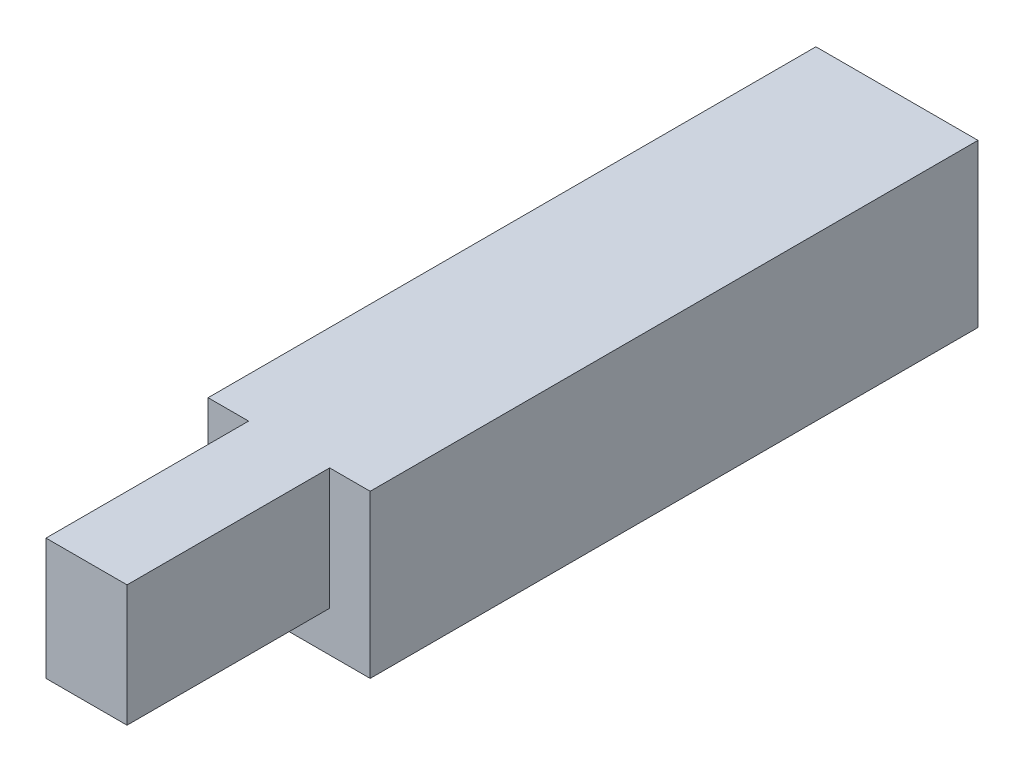
from build123d import *

# Parameters (mm, degrees)
SKETCH1_W           = 10
SKETCH1_H           = 10
BOSS_EXTRUDE1_DEPTH = 37.5
SKETCH2_W           = 5
SKETCH2_H           = 7.5
BOSS_EXTRUDE2_DEPTH = 12.5


with BuildPart() as part:
    # Sketch1 → Boss-Extrude1 (new body)
    with BuildSketch(Plane.XY):
        Rectangle(SKETCH1_W, SKETCH1_H)
    extrude(amount=BOSS_EXTRUDE1_DEPTH)

    # Sketch2 → Boss-Extrude2 (add)
    with BuildSketch(Plane.XY.offset(37.5)):
        with Locations((0, 1.25)):
            Rectangle(SKETCH2_W, SKETCH2_H)
    extrude(amount=BOSS_EXTRUDE2_DEPTH)


solid = part.part
